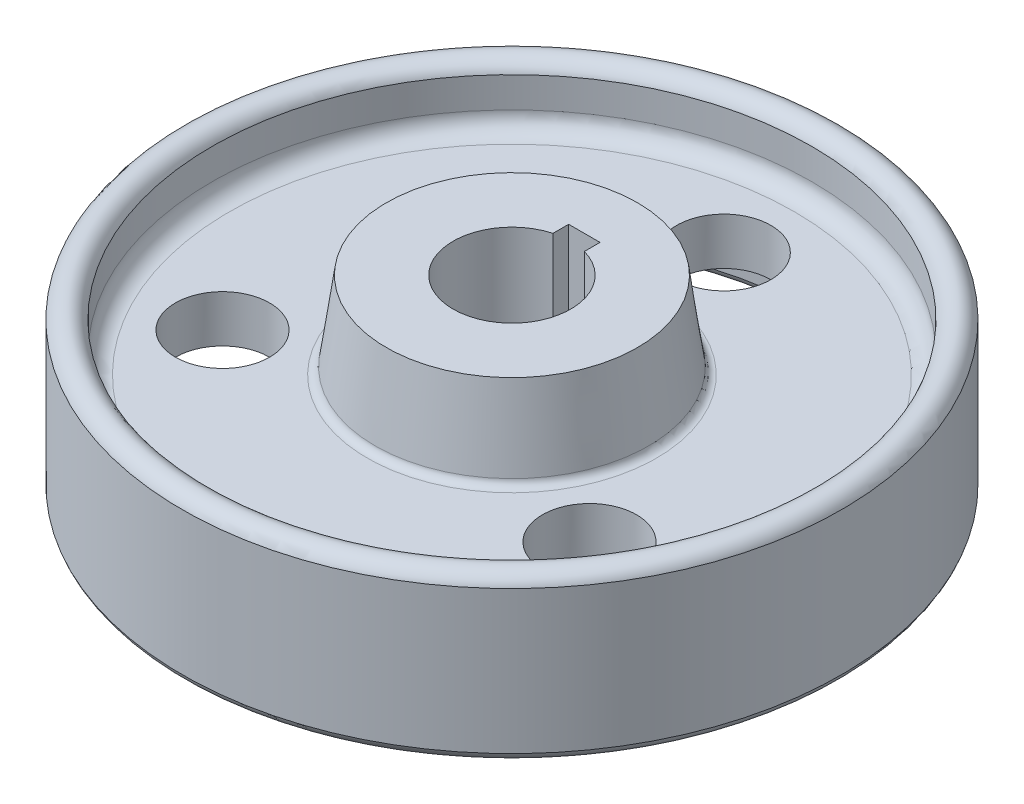
from build123d import *

# Parameters (mm, degrees)
CHANNEL_DEPTH           = 127
ESQUISSE8_R             = 9.525
ENL_V_MAT_EXTRU_4_DEPTH = 127


with BuildPart() as part:
    # Esquisse6 → Tour complet (revolve)
    with BuildSketch(Plane(origin=(0, 0, 0), x_dir=(0, 0, -1), z_dir=(1, 0, 0))):
        with BuildLine():
            Line((11.90625, -22.225), (11.90625, 22.225))
            Line((11.90625, 22.225), (25.4, 22.225))
            Line((25.4, 22.225), (27.662136463, 6.129062702))
            ThreePointArc((27.662136463, 6.129062702), (28.192693314, 5.151898541), (29.234187022, 4.7625))
            Line((29.234187022, 4.7625), (57.15, 4.7625))
            ThreePointArc((57.15, 4.7625), (59.635400927, 5.791986772), (60.664887699, 8.277387699))
            Line((60.664887699, 8.277387699), (60.664887699, 14.45744385))
            ThreePointArc((60.664887699, 14.45744385), (63.66994385, 16.607620678), (66.675, 14.45744385))
            Line((66.675, 14.45744385), (66.675, -14.45744385))
            ThreePointArc((66.675, -14.45744385), (63.66994385, -16.607620678), (60.664887699, -14.45744385))
            Line((60.664887699, -14.45744385), (60.664887699, -8.277387699))
            ThreePointArc((60.664887699, -8.277387699), (59.635400927, -5.791986772), (57.15, -4.7625))
            Line((57.15, -4.7625), (29.234187022, -4.7625))
            ThreePointArc((29.234187022, -4.7625), (28.192693314, -5.151898541), (27.662136463, -6.129062702))
            Line((27.662136463, -6.129062702), (25.4, -22.225))
            Line((25.4, -22.225), (11.90625, -22.225))
        make_face()
    revolve(axis=Axis((0, 0, 0), (0, 1, 0)))

    # Esquisse7 → Channel (cut)
    with BuildSketch(Plane(origin=(0, 22.225, 0), x_dir=(1, 0, 0), z_dir=(0, 1, 0))):
        with BuildLine():
            Line((-3.175, 14.650110634), (3.175, 14.650110634))
            Line((3.175, 14.650110634), (3.175, 11.475110634))
            ThreePointArc((3.175, 11.475110634), (0, 11.90625), (-3.175, 11.475110634))
            Line((-3.175, 11.475110634), (-3.175, 14.650110634))
        make_face()
    extrude(amount=-CHANNEL_DEPTH, mode=Mode.SUBTRACT)

    # Esquisse8 → Enlèv. mat.-Extru.4 (cut)
    with BuildSketch(Plane(origin=(0, 4.7625, 0), x_dir=(1, 0, 0), z_dir=(0, 1, 0))):
        with Locations(Location((0, 42.8625, 0), (0, 0, 270))):
            Circle(ESQUISSE8_R)
        with Locations(Location((-37.12001387, -21.43125, 0), (0, 0, 270))):
            Circle(ESQUISSE8_R)
        with Locations(Location((37.12001387, -21.43125, 0), (0, 0, 270))):
            Circle(ESQUISSE8_R)
    extrude(amount=-ENL_V_MAT_EXTRU_4_DEPTH, mode=Mode.SUBTRACT)


solid = part.part
